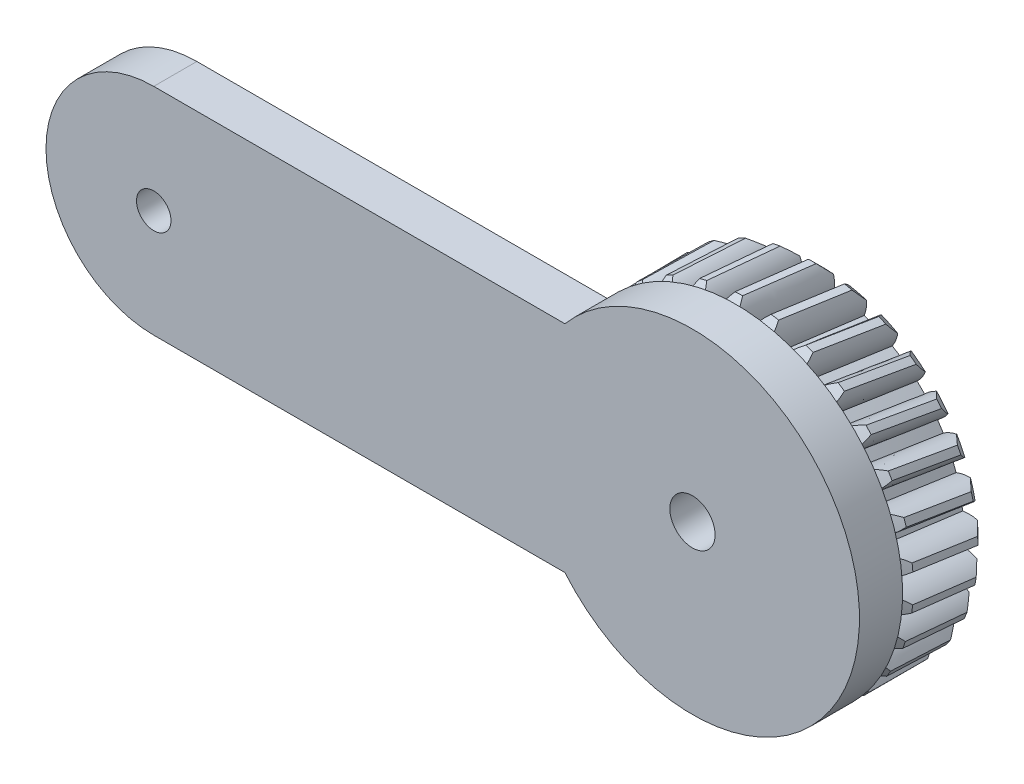
from build123d import *

# Parameters (mm, degrees)
SKETCH5_R           = 15.5
BOSS_EXTRUDE1_DEPTH = 8
CHAMFER1_SIZE       = 1
CUT_SWEEP1_PITCH    = 704.225352113
CUT_SWEEP1_HEIGHT   = 20
CUT_SWEEP1_RADIUS   = 15.5
CIRPATTERN1_COUNT   = 29
BOSS_EXTRUDE2_START = 8
SKETCH12_R          = 1.6
BOSS_EXTRUDE2_DEPTH = 4
SKETCH11_R          = 2.1
CUT_EXTRUDE1_DEPTH  = 15


with BuildPart() as part:
    # Sketch5 → Boss-Extrude1 (new body)
    with BuildSketch(Plane(origin=(0, 0, 0), x_dir=(0, 1, 0), z_dir=(0, 0, 1))):
        with Locations(Location((0, 0, 0), (0, 0, 270))):
            Circle(SKETCH5_R)
    extrude(amount=BOSS_EXTRUDE1_DEPTH)

    # Chamfer1
    chamfer1_edges = [part.edges().sort_by_distance(p)[0] for p in [
        (-15.5, 0, 0),
        (-15.5, 0, 8),
    ]]
    chamfer(chamfer1_edges, length=CHAMFER1_SIZE)

    # Cut-Sweep1: sweep along a helix
    with BuildLine() as cut_sweep1_path:
        Helix(CUT_SWEEP1_PITCH, CUT_SWEEP1_HEIGHT, CUT_SWEEP1_RADIUS, center=(0, 0, 8), direction=(0, 0, -1))
    # Sketch10 → Cut-Sweep1 (sweep, cut)
    with BuildSketch(Plane.XY.offset(8)):
        with BuildLine():
            Line((13.143263094, 0.5), (13.143263094, -0.5))
            ThreePointArc((13.143263094, -0.5), (14.372434934, -0.691778507), (15.443263094, -1.325))
            ThreePointArc((15.443263094, -1.325), (15.5, 0), (15.443263094, 1.325))
            ThreePointArc((15.443263094, 1.325), (14.372434934, 0.691778507), (13.143263094, 0.5))
        make_face()
    cut_sweep1 = sweep(path=cut_sweep1_path.line, is_frenet=True, mode=Mode.SUBTRACT)

    # CirPattern1: Cut-Sweep1 ×29 about axis
    cirpattern1_axis = Axis((0, 0, 8), (0, 0, -1))
    for i in range(1, CIRPATTERN1_COUNT):
        add(cut_sweep1.rotate(cirpattern1_axis, i * 360 / CIRPATTERN1_COUNT), mode=Mode.SUBTRACT)

    # Sketch12 → Boss-Extrude2 (add)
    with BuildSketch(Plane(origin=(0, 0, 0), x_dir=(0, 1, 0), z_dir=(0, 0, 1)).offset(BOSS_EXTRUDE2_START)):
        with BuildLine():
            Line((10, 50), (10, 11.842719282))
            ThreePointArc((10, 11.842719282), (0, -15.5), (-10, 11.842719282))
            Line((-10, 11.842719282), (-10, 50))
            ThreePointArc((-10, 50), (0, 60), (10, 50))
        make_face()
        with Locations(Location((0, 50, 0), (0, 0, 270))):
            Circle(SKETCH12_R, mode=Mode.SUBTRACT)
    extrude(amount=BOSS_EXTRUDE2_DEPTH)

    # Sketch11 → Cut-Extrude1 (cut)
    with BuildSketch(Plane(origin=(0, 0, 0), x_dir=(0, 1, 0), z_dir=(0, 0, 1))):
        with Locations(Location((0, 0, 0), (0, 0, 270))):
            Circle(SKETCH11_R)
    extrude(amount=CUT_EXTRUDE1_DEPTH, mode=Mode.SUBTRACT)


solid = part.part
